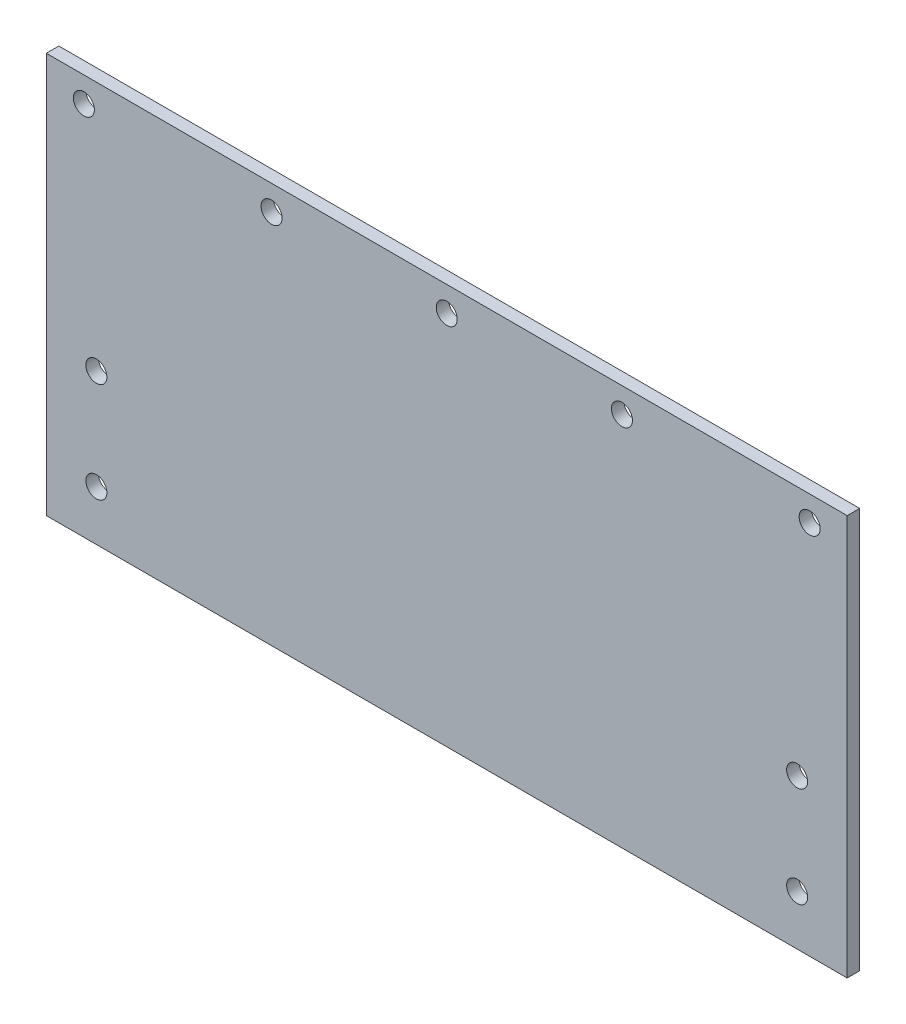
from build123d import *

# Parameters (mm, degrees)
SKETCH1_W            = 320
SKETCH1_H            = 160
BOSS_EXTRUDE1_DEPTH  = 5
M8_CLEARANCE_HOLE1_D = 8.4


with BuildPart() as part:
    # Sketch1 → Boss-Extrude1 (new body)
    with BuildSketch(Plane.XY):
        Rectangle(SKETCH1_W, SKETCH1_H)
    extrude(amount=BOSS_EXTRUDE1_DEPTH)

    # M8 Clearance Hole1 (through all)
    with Locations(Plane.XY.offset(5)):
        with Locations((-145, 70), (-70, 70), (0, 70), (70, 70), (145, 70), (-140, -20), (-140, -60), (140, -20), (140, -60)):
            Hole(M8_CLEARANCE_HOLE1_D / 2)


solid = part.part
